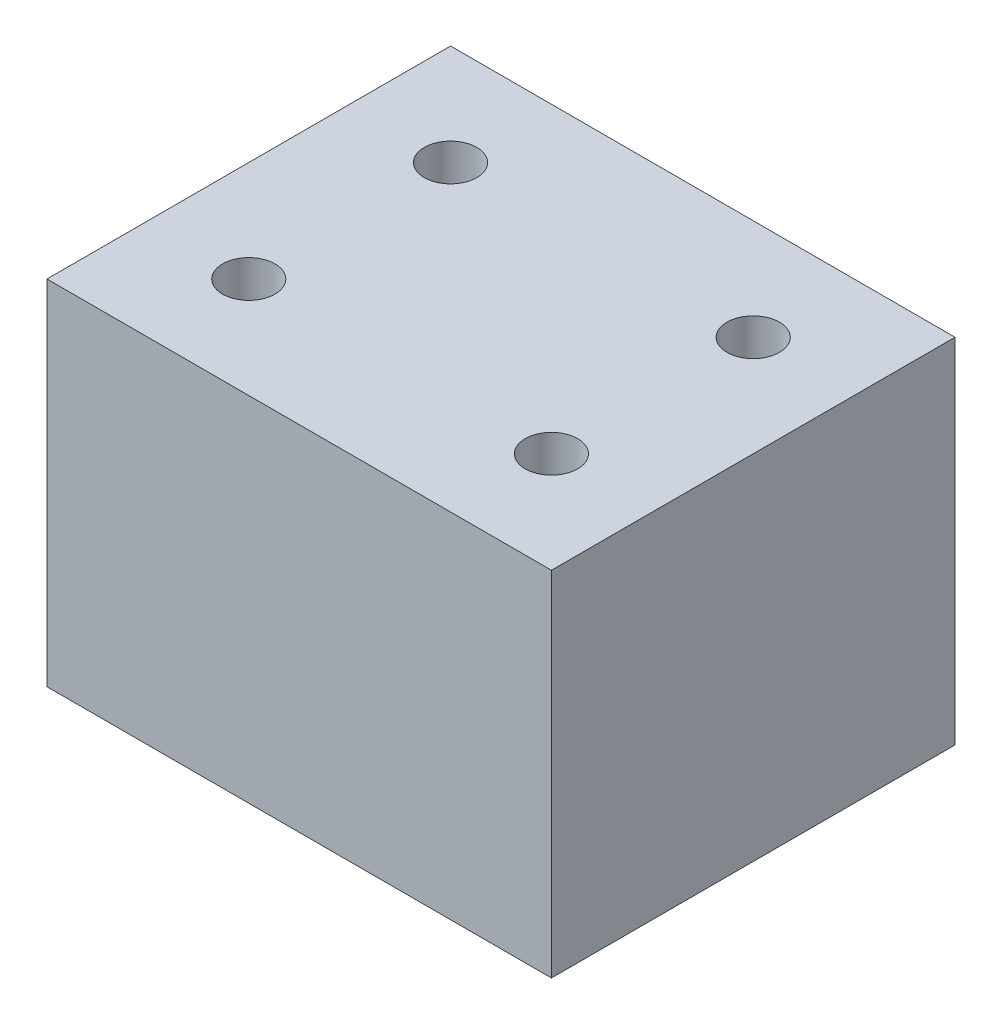
from build123d import *

# Parameters (mm, degrees)
SKETCH_1_W          = 50
SKETCH_1_H          = 40
EXTRUDE_1_DEPTH     = 35
SKETCH_2_R          = 2.6
CUT_EXTRUDE_1_DEPTH = 48.434164903


with BuildPart() as part:
    # 草图1 → 凸台-拉伸1 (new body)
    with BuildSketch(Plane(origin=(0, 0, 0), x_dir=(1, 0, 0), z_dir=(0, 1, 0))):
        Rectangle(SKETCH_1_W, SKETCH_1_H)
    extrude(amount=EXTRUDE_1_DEPTH)

    # 草图2 → 切除-拉伸1 (cut, through all)
    with BuildSketch(Plane(origin=(0, 35, 0), x_dir=(1, 0, 0), z_dir=(0, 1, 0))):
        with Locations(Location((-15, -10, 0), (0, 0, 270))):
            Circle(SKETCH_2_R)
        with Locations(Location((15, -10, 0), (0, 0, 270))):
            Circle(SKETCH_2_R)
        with Locations(Location((-15, 10, 0), (0, 0, 270))):
            Circle(SKETCH_2_R)
        with Locations(Location((15, 10, 0), (0, 0, 270))):
            Circle(SKETCH_2_R)
    extrude(amount=-CUT_EXTRUDE_1_DEPTH, mode=Mode.SUBTRACT)


solid = part.part
